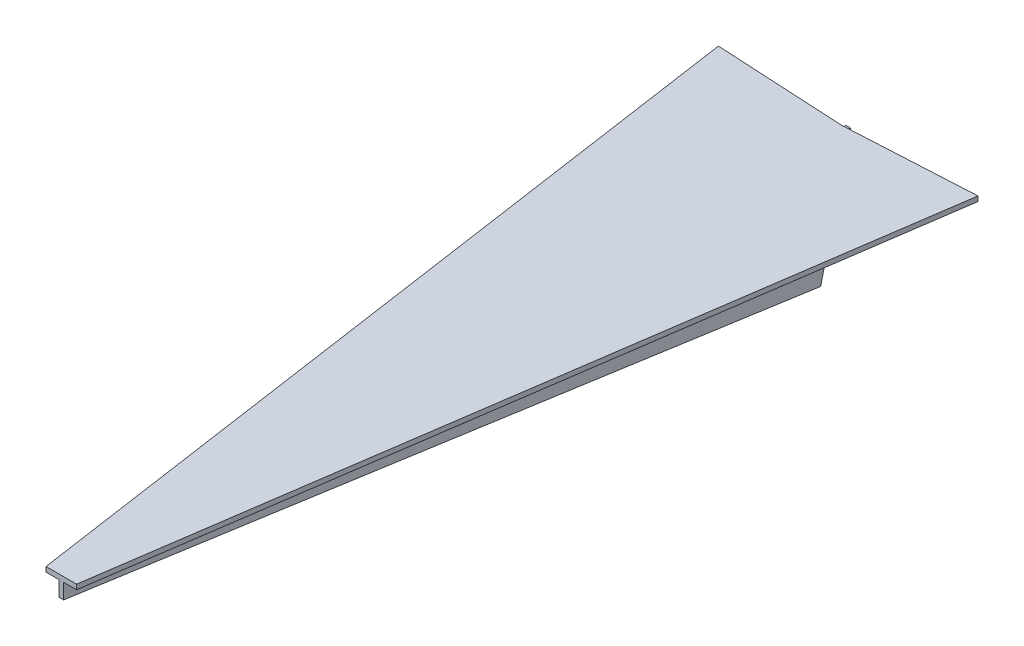
from build123d import *

# Parameters (mm, degrees)
EXTRUDE_1_DEPTH = 1.6
EXTRUDE_2_DEPTH = 0.75


with BuildPart() as part:
    # ｽｹｯﾁ1 → ﾎﾞｽ - 押し出し1 (new body)
    with BuildSketch(Plane(origin=(0, 0, 0), x_dir=(1, 0, 0), z_dir=(0, 1, 0))):
        Polygon((0, 255), (42.438235274, 257.290455594), (5, 0), (-5, 0), (-42.438235274, 257.290455594), align=None)
    extrude(amount=EXTRUDE_1_DEPTH)

    # ｽｹｯﾁ2 → ﾎﾞｽ - 押し出し2 (add, symmetric)
    with BuildSketch(Plane(origin=(0, 0, 0), x_dir=(0, 0, -1), z_dir=(1, 0, 0))):
        Polygon((0, 0), (0, -5), (247.53787589, -40), (257.290455594, 0), align=None)
    extrude(amount=EXTRUDE_2_DEPTH, both=True)


solid = part.part
